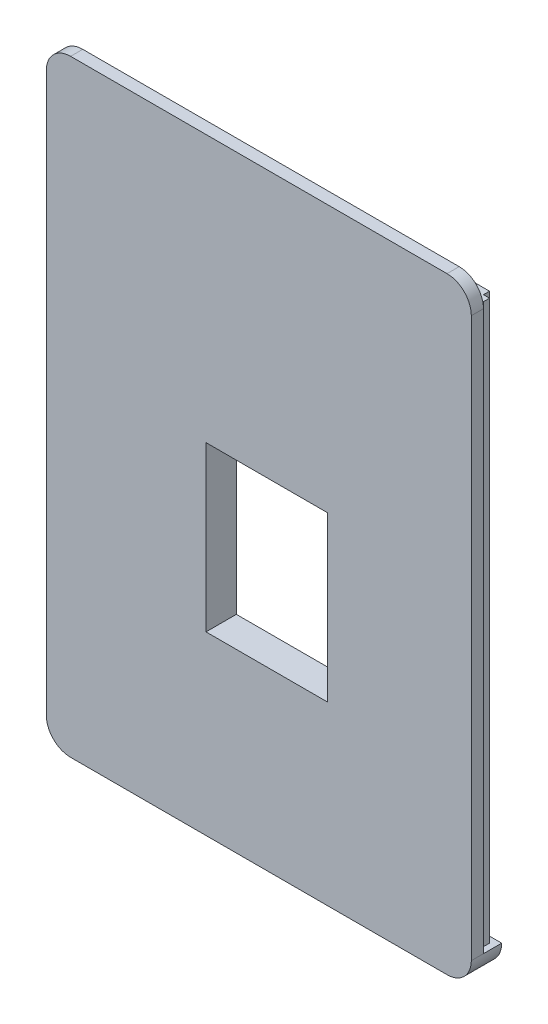
from build123d import *

# Parameters (mm, degrees)
SKETCH1_W           = 100
SKETCH1_H           = 70
BOSS_EXTRUDE1_DEPTH = 5
FILLET1_R           = 4
SKETCH3_W           = 20
SKETCH3_H           = 27
CUT_EXTRUDE1_DEPTH  = 5
CUT_EXTRUDE2_DEPTH  = 96
SKETCH6_W           = 70
SKETCH6_H           = 3
CUT_EXTRUDE3_DEPTH  = 4


with BuildPart() as part:
    # Sketch1 → Boss-Extrude1 (new body)
    with BuildSketch(Plane(origin=(0, 0, 0), x_dir=(0, 1, 0), z_dir=(0, 0, 1))):
        Rectangle(SKETCH1_W, SKETCH1_H)
    extrude(amount=BOSS_EXTRUDE1_DEPTH)

    # Fillet1
    fillet1_edges = [part.edges().sort_by_distance(p)[0] for p in [
        (35, 50, 2.5),
        (35, -50, 2.5),
        (-35, -50, 2.5),
        (-35, 50, 2.5),
    ]]
    fillet(fillet1_edges, radius=FILLET1_R)

    # Sketch3 → Cut-Extrude1 (cut)
    with BuildSketch(Plane(origin=(0, 0, 0), x_dir=(1, 0, 0), z_dir=(0, 0, -1))):
        with Locations((1.3, 7.45)):
            Rectangle(SKETCH3_W, SKETCH3_H)
    extrude(amount=-CUT_EXTRUDE1_DEPTH, mode=Mode.SUBTRACT)

    # Sketch5 → Cut-Extrude2 (cut)
    with BuildSketch(Plane(origin=(0, 50, 0), x_dir=(-1, 0, 0), z_dir=(0, 1, 0))):
        Polygon((-35, 3), (-33, 3), (-33, 2), (-34, 2), (-34, 1), (-33, 1), (-33, 0), (-35, 0), align=None)
        Polygon((35, 3), (35, 0), (33, 0), (33, 1), (34, 1), (34, 2), (33, 2), (33, 3), align=None)
    extrude(amount=-CUT_EXTRUDE2_DEPTH, mode=Mode.SUBTRACT)

    # Sketch6 → Cut-Extrude3 (cut)
    with BuildSketch(Plane(origin=(0, 50, 0), x_dir=(-1, 0, 0), z_dir=(0, 1, 0))):
        with Locations((0, 1.5)):
            Rectangle(SKETCH6_W, SKETCH6_H)
    extrude(amount=-CUT_EXTRUDE3_DEPTH, mode=Mode.SUBTRACT)


solid = part.part
